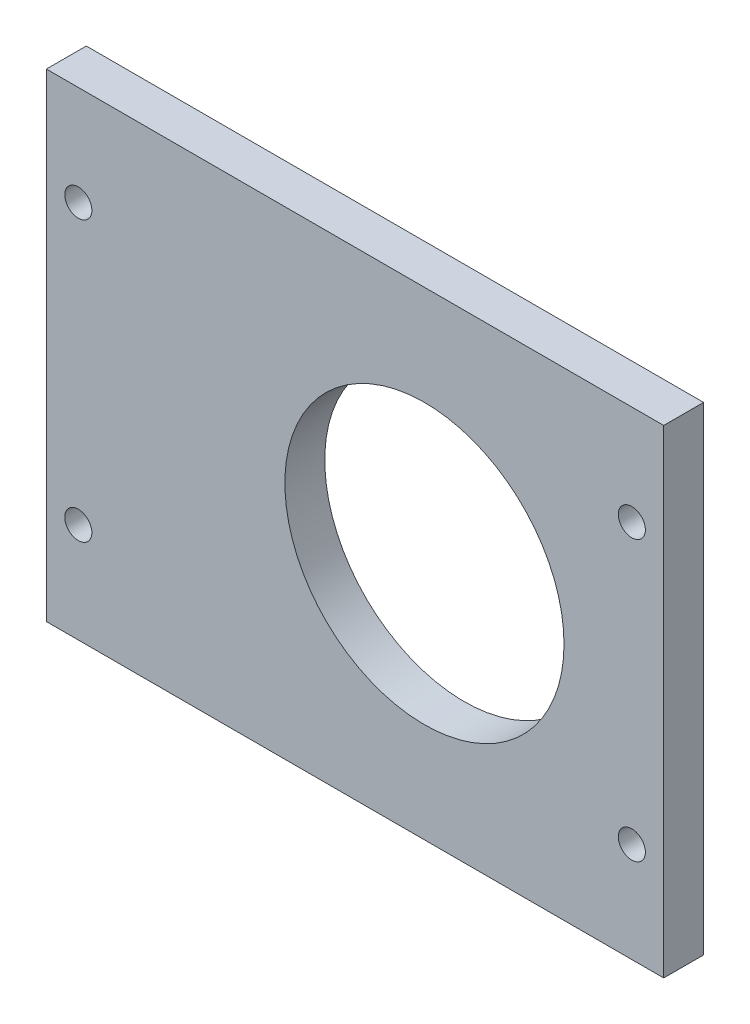
from build123d import *

# Parameters (mm, degrees)
SKETCH_1_W              = 77.4
SKETCH_1_H              = 60
EXTRUDE_1_DEPTH         = 5
SKETCH_2_R              = 17.5
CUT_EXTRUDE_1_DEPTH     = 99.059981644
HOLE_WIZARD_3_4_3_4_2_D = 3.4


with BuildPart() as part:
    # ｽｹｯﾁ1 → ﾎﾞｽ - 押し出し1 (new body)
    with BuildSketch(Plane.XY):
        with Locations((38.7, 30)):
            Rectangle(SKETCH_1_W, SKETCH_1_H)
    extrude(amount=EXTRUDE_1_DEPTH)

    # ｽｹｯﾁ2 → ｶｯﾄ - 押し出し1 (cut, through all)
    with BuildSketch(Plane.XY.offset(5)):
        with Locations((47.4, 30)):
            Circle(SKETCH_2_R)
    extrude(amount=-CUT_EXTRUDE_1_DEPTH, mode=Mode.SUBTRACT)

    # Ø3.4 (3.4) 直径の穴2 (through all)
    with Locations(Plane(origin=(73.4, 47.5, 5), x_dir=(1, 0, 0), z_dir=(0, 0, 1))):
        with Locations((0, 0), (0, -35), (-69.4, -35), (-69.4, 0)):
            Hole(HOLE_WIZARD_3_4_3_4_2_D / 2)


solid = part.part
